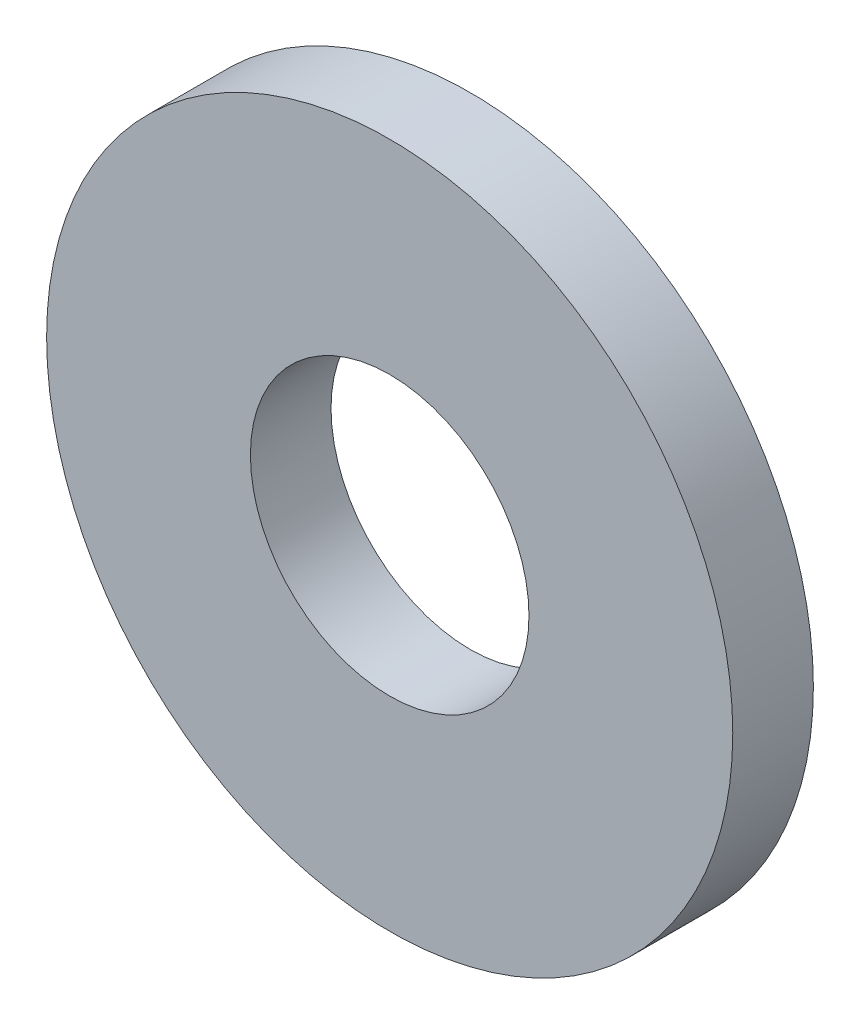
from build123d import *

# Parameters (mm, degrees)
SKETCH2_R           = 12.7
SKETCH2_R_2         = 5.1562
BOSS_EXTRUDE1_DEPTH = 1.49225


with BuildPart() as part:
    # Sketch2 → Boss-Extrude1 (new, symmetric)
    with BuildSketch(Plane.XY):
        Circle(SKETCH2_R)
        Circle(SKETCH2_R_2, mode=Mode.SUBTRACT)
    extrude(amount=BOSS_EXTRUDE1_DEPTH, both=True)


solid = part.part
